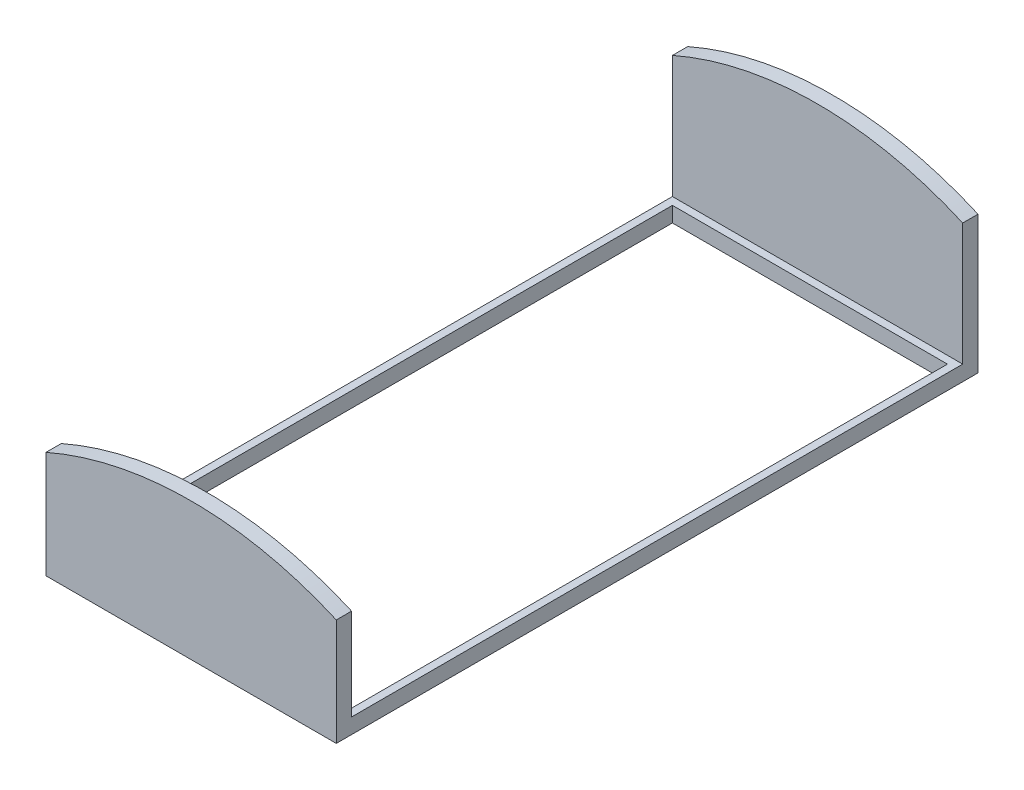
from build123d import *

# Parameters (mm, degrees)
CROQUIS1_W               = 950
CROQUIS1_H               = 2000
CROQUIS1_W_2             = 900
CROQUIS1_H_2             = 1950
SALIENTE_EXTRUIR1_DEPTH  = 50
CROQUIS3_W               = 950
CROQUIS3_H               = 50
SALIENTE_EXTRUIR3_DEPTH  = 50
CROQUIS6_W               = 950
CROQUIS6_H               = 50
SALIENTE_EXTRUIR6_DEPTH  = 50
CROQUIS4_W               = 950
CROQUIS4_H               = 50
SALIENTE_EXTRUIR7_DEPTH  = 400
SALIENTE_EXTRUIR8_DEPTH  = 50
CROQUIS9_W               = 950
CROQUIS9_H               = 50
SALIENTE_EXTRUIR9_DEPTH  = 300
SALIENTE_EXTRUIR10_DEPTH = 50


with BuildPart() as part:
    # Croquis1 → Saliente-Extruir1 (new body)
    with BuildSketch(Plane(origin=(0, 0, 0), x_dir=(1, 0, 0), z_dir=(0, 1, 0))):
        Rectangle(CROQUIS1_W, CROQUIS1_H)
        Rectangle(CROQUIS1_W_2, CROQUIS1_H_2, mode=Mode.SUBTRACT)
    extrude(amount=SALIENTE_EXTRUIR1_DEPTH)

    # Croquis3 → Saliente-Extruir3 (add)
    with BuildSketch(Plane(origin=(0, 0, -1000), x_dir=(-1, 0, 0), z_dir=(0, 0, -1))):
        with Locations((0, 25)):
            Rectangle(CROQUIS3_W, CROQUIS3_H)
    extrude(amount=SALIENTE_EXTRUIR3_DEPTH)

    # Croquis6 → Saliente-Extruir6 (add)
    with BuildSketch(Plane.XY.offset(1000)):
        with Locations((0, 25)):
            Rectangle(CROQUIS6_W, CROQUIS6_H)
    extrude(amount=SALIENTE_EXTRUIR6_DEPTH)

    # Croquis4 → Saliente-Extruir7 (add)
    with BuildSketch(Plane(origin=(0, 50, 0), x_dir=(1, 0, 0), z_dir=(0, 1, 0))):
        with Locations((0, 1025)):
            Rectangle(CROQUIS4_W, CROQUIS4_H)
    extrude(amount=SALIENTE_EXTRUIR7_DEPTH)

    # Croquis8 → Saliente-Extruir8 (add)
    with BuildSketch(Plane(origin=(0, 0, -1050), x_dir=(-1, 0, 0), z_dir=(0, 0, -1))):
        with BuildLine():
            Line((-475, 450), (475, 450))
            ThreePointArc((475, 450), (0, 550.017484419), (-475, 450))
        make_face()
    extrude(amount=-SALIENTE_EXTRUIR8_DEPTH)

    # Croquis9 → Saliente-Extruir9 (add)
    with BuildSketch(Plane(origin=(0, 50, 0), x_dir=(1, 0, 0), z_dir=(0, 1, 0))):
        with Locations((0, -1025)):
            Rectangle(CROQUIS9_W, CROQUIS9_H)
    extrude(amount=SALIENTE_EXTRUIR9_DEPTH)

    # Croquis10 → Saliente-Extruir10 (add)
    with BuildSketch(Plane.XY.offset(1050)):
        with BuildLine():
            Line((-475, 350), (475, 350))
            ThreePointArc((475, 350), (0, 449.957514301), (-475, 350))
        make_face()
    extrude(amount=-SALIENTE_EXTRUIR10_DEPTH)


solid = part.part
